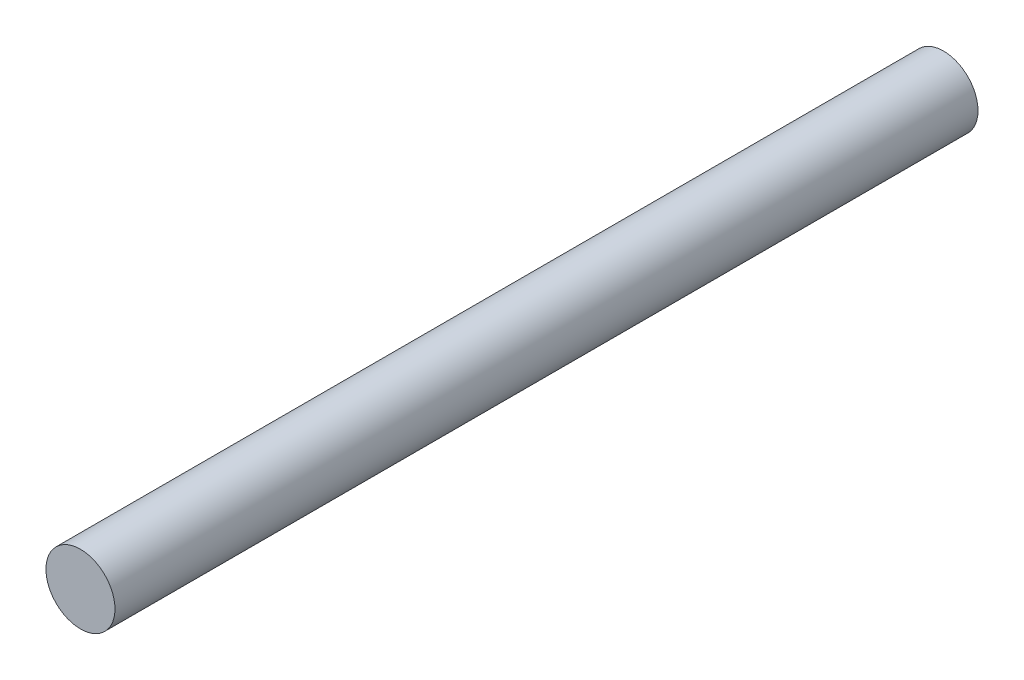
from build123d import *

# Parameters (mm, degrees)
BOSS_EXTRUDE1_DEPTH      = 80
BOSS_EXTRUDE1_DEPTH_BACK = 25
SKETCH1_R                = 4.2


with BuildPart() as part:
    # Sketch1 → Boss-Extrude1 (new, two sides: drawn at the far end of the back side and taken through both)
    with BuildSketch(Plane.XY.offset(-BOSS_EXTRUDE1_DEPTH_BACK)):
        with Locations((-171.600500868, 12.5)):
            Circle(SKETCH1_R)
    extrude(amount=BOSS_EXTRUDE1_DEPTH + BOSS_EXTRUDE1_DEPTH_BACK)


solid = part.part
